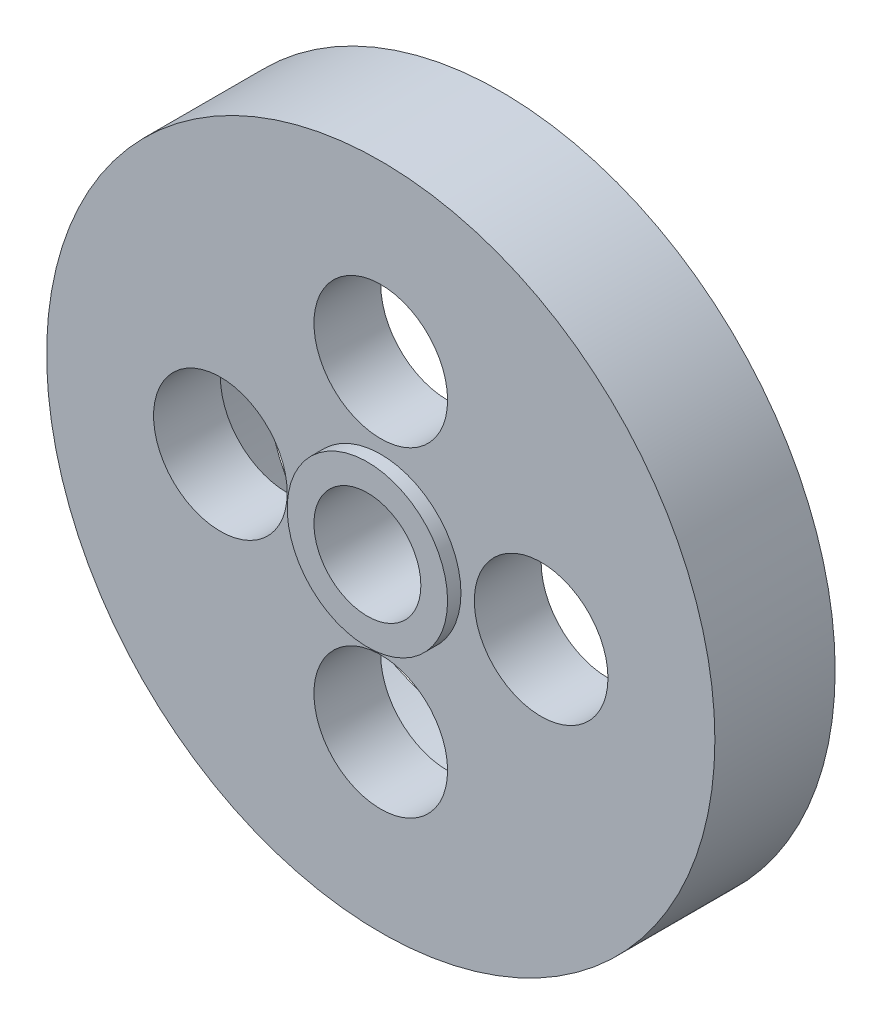
from build123d import *

# Parameters (mm, degrees)
SKETCH1_R           = 25
SKETCH1_R_2         = 4
SKETCH1_R_3         = 5
BOSS_EXTRUDE1_DEPTH = 9
SKETCH2_R           = 18
CUT_EXTRUDE1_DEPTH  = 4
BOSS_EXTRUDE2_START = 1
SKETCH3_R           = 6
SKETCH3_R_2         = 4
BOSS_EXTRUDE2_DEPTH = 1
CUT_EXTRUDE2_START  = -1
SKETCH5_R           = 6
CUT_EXTRUDE2_DEPTH  = 1
SKETCH6_R           = 6
SKETCH6_R_2         = 4
BOSS_EXTRUDE3_DEPTH = 1


with BuildPart() as part:
    # Sketch1 → Boss-Extrude1 (new body)
    with BuildSketch(Plane.XY):
        Circle(SKETCH1_R)
        Circle(SKETCH1_R_2, mode=Mode.SUBTRACT)
        with Locations((0, 12)):
            Circle(SKETCH1_R_3, mode=Mode.SUBTRACT)
        with Locations((12, 0)):
            Circle(SKETCH1_R_3, mode=Mode.SUBTRACT)
        with Locations((0, -12)):
            Circle(SKETCH1_R_3, mode=Mode.SUBTRACT)
        with Locations((-12, 0)):
            Circle(SKETCH1_R_3, mode=Mode.SUBTRACT)
    extrude(amount=-BOSS_EXTRUDE1_DEPTH)

    # Sketch2 → Cut-Extrude1 (cut)
    with BuildSketch(Plane(origin=(0, 0, -9), x_dir=(-1, 0, 0), z_dir=(0, 0, -1))):
        Circle(SKETCH2_R)
    extrude(amount=-CUT_EXTRUDE1_DEPTH, mode=Mode.SUBTRACT)

    # Sketch3 → Boss-Extrude2 (add)
    with BuildSketch(Plane.XY.offset(BOSS_EXTRUDE2_START)):
        Circle(SKETCH3_R)
        Circle(SKETCH3_R_2, mode=Mode.SUBTRACT)
    extrude(amount=-BOSS_EXTRUDE2_DEPTH)

    # Sketch5 → Cut-Extrude2 (cut)
    with BuildSketch(Plane(origin=(0, 0, -5), x_dir=(-1, 0, 0), z_dir=(0, 0, -1)).offset(CUT_EXTRUDE2_START)):
        with Locations(Location((0, 0, 0), (0, 0, 180))):
            Circle(SKETCH5_R)
    extrude(amount=CUT_EXTRUDE2_DEPTH, mode=Mode.SUBTRACT)

    # Sketch6 → Boss-Extrude3 (add)
    with BuildSketch(Plane(origin=(0, 0, -4), x_dir=(-1, 0, 0), z_dir=(0, 0, -1))):
        with Locations(Location((0, 0, 0), (0, 0, 180))):
            Circle(SKETCH6_R)
        with Locations(Location((0, 0, 0), (0, 0, 180))):
            Circle(SKETCH6_R_2, mode=Mode.SUBTRACT)
    extrude(amount=BOSS_EXTRUDE3_DEPTH)


solid = part.part
